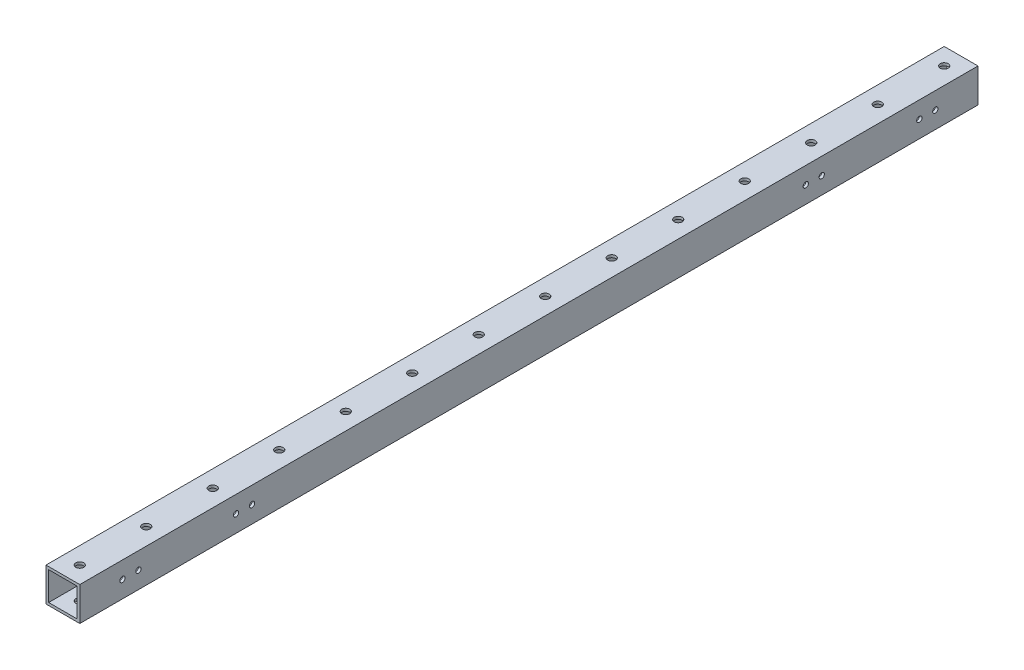
from build123d import *

# Parameters (mm, degrees)
SKETCH1_W               = 25.4
SKETCH1_H               = 25.4
SKETCH1_W_2             = 21.4
SKETCH1_H_2             = 21.4
BOSS_EXTRUDE1_DEPTH     = 675.4
SKETCH3_R               = 3
CUT_EXTRUDE1_DEPTH      = 650
CUT_EXTRUDE2_DEPTH      = 676.996752951
CUT_EXTRUDE2_DEPTH_BACK = 676.996752951
SKETCH4_R               = 2


with BuildPart() as part:
    # Sketch1 → Boss-Extrude1 (new body)
    with BuildSketch(Plane.XY):
        Rectangle(SKETCH1_W, SKETCH1_H)
        Rectangle(SKETCH1_W_2, SKETCH1_H_2, mode=Mode.SUBTRACT)
    extrude(amount=BOSS_EXTRUDE1_DEPTH)

    # Sketch3 → Cut-Extrude1 (cut)
    with BuildSketch(Plane(origin=(0, 12.7, 0), x_dir=(1, 0, 0), z_dir=(0, 1, 0))):
        with Locations(Location((0, -662.7, 0), (0, 0, 180))):
            Circle(SKETCH3_R)
        with Locations(Location((0, -612.7, 0), (0, 0, 180))):
            Circle(SKETCH3_R)
        with Locations(Location((0, -562.7, 0), (0, 0, 180))):
            Circle(SKETCH3_R)
        with Locations(Location((0, -512.7, 0), (0, 0, 180))):
            Circle(SKETCH3_R)
        with Locations(Location((0, -462.7, 0), (0, 0, 180))):
            Circle(SKETCH3_R)
        with Locations(Location((0, -412.7, 0), (0, 0, 180))):
            Circle(SKETCH3_R)
        with Locations(Location((0, -362.7, 0), (0, 0, 180))):
            Circle(SKETCH3_R)
        with Locations(Location((0, -312.7, 0), (0, 0, 180))):
            Circle(SKETCH3_R)
        with Locations(Location((0, -262.7, 0), (0, 0, 180))):
            Circle(SKETCH3_R)
        with Locations(Location((0, -212.7, 0), (0, 0, 180))):
            Circle(SKETCH3_R)
        with Locations(Location((0, -162.7, 0), (0, 0, 180))):
            Circle(SKETCH3_R)
        with Locations(Location((0, -112.7, 0), (0, 0, 180))):
            Circle(SKETCH3_R)
        with Locations(Location((0, -62.7, 0), (0, 0, 180))):
            Circle(SKETCH3_R)
        with Locations(Location((0, -12.7, 0), (0, 0, 180))):
            Circle(SKETCH3_R)
    extrude(amount=-CUT_EXTRUDE1_DEPTH, mode=Mode.SUBTRACT)

    # Sketch4 → Cut-Extrude2 (cut, two sides: drawn at the far end of the back side and taken through both)
    with BuildSketch(Plane(origin=(12.7, 0, 0), x_dir=(0, 0, -1), z_dir=(1, 0, 0)).offset(-CUT_EXTRUDE2_DEPTH_BACK)):
        with Locations((-44.1, 0)):
            Circle(SKETCH4_R)
        with Locations((-32.1, 0)):
            Circle(SKETCH4_R)
        with Locations((-117.5, 0)):
            Circle(SKETCH4_R)
        with Locations((-129.5, 0)):
            Circle(SKETCH4_R)
        with Locations(Location((-643.3, 0, 0), (0, 0, 90))):
            Circle(SKETCH4_R)
        with Locations(Location((-631.3, 0, 0), (0, 0, 90))):
            Circle(SKETCH4_R)
        with Locations(Location((-557.9, 0, 0), (0, 0, 90))):
            Circle(SKETCH4_R)
        with Locations(Location((-545.9, 0, 0), (0, 0, 90))):
            Circle(SKETCH4_R)
    extrude(amount=CUT_EXTRUDE2_DEPTH + CUT_EXTRUDE2_DEPTH_BACK, mode=Mode.SUBTRACT)


solid = part.part
